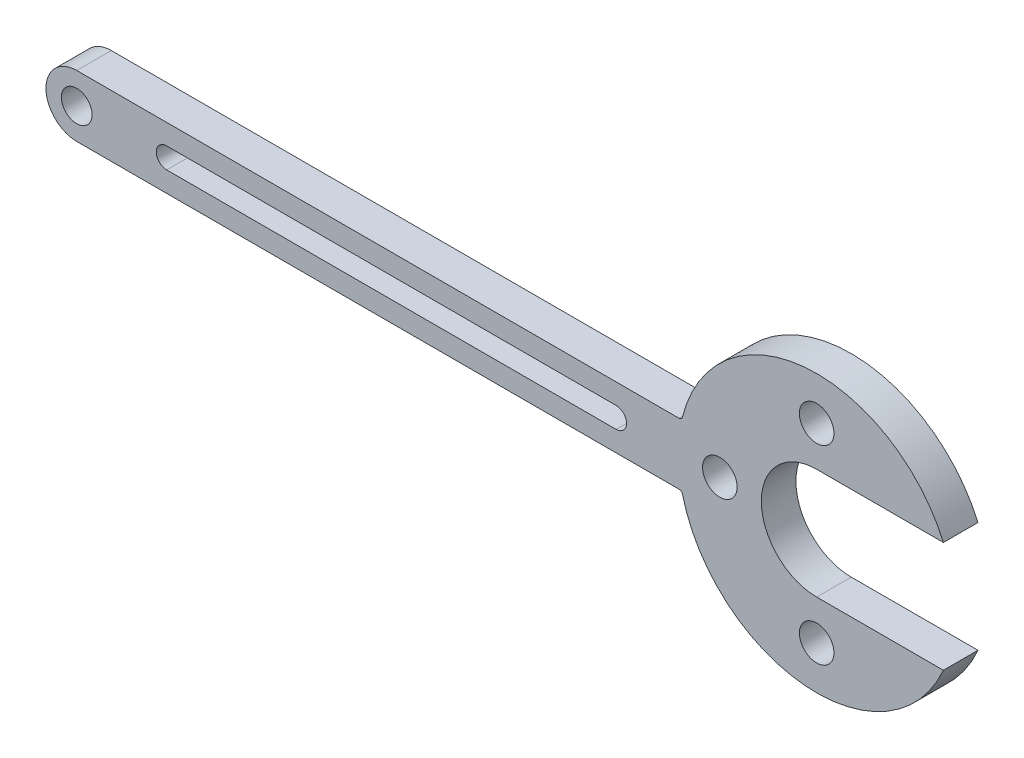
from build123d import *

# Parameters (mm, degrees)
SKETCH1_R           = 5
SKETCH1_R_2         = 4.435
BOSS_EXTRUDE1_DEPTH = 5


with BuildPart() as part:
    # Sketch1 → Boss-Extrude1 (new, symmetric)
    with BuildSketch(Plane.XY):
        with BuildLine():
            Line((36.66060556, 16), (0, 16))
            ThreePointArc((0, 16), (-16, 0), (0, -16))
            Line((0, -16), (36.66060556, -16))
            ThreePointArc((36.66060556, -16), (-3.354853263, -39.859063707), (-38.819261012, -9.647018944))
            ThreePointArc((-38.819261012, -9.647018944), (-39.173778039, -9.100420505), (-39.789742537, -8.888194417))
            Line((-39.789742537, -8.888194417), (-214, -8.888194417))
            ThreePointArc((-214, -8.888194417), (-222.888194417, 0), (-214, 8.888194417))
            Line((-214, 8.888194417), (-39.789742537, 8.888194417))
            ThreePointArc((-39.789742537, 8.888194417), (-39.173778039, 9.100420505), (-38.819261012, 9.647018944))
            ThreePointArc((-38.819261012, 9.647018944), (-3.354853263, 39.859063707), (36.66060556, 16))
        make_face()
        with Locations((0, 27.5)):
            Circle(SKETCH1_R, mode=Mode.SUBTRACT)
        with Locations((-28, 0)):
            Circle(SKETCH1_R, mode=Mode.SUBTRACT)
        with Locations((0, -27.5)):
            Circle(SKETCH1_R, mode=Mode.SUBTRACT)
        with Locations((-214, 0)):
            Circle(SKETCH1_R_2, mode=Mode.SUBTRACT)
        with BuildLine():
            Line((-188, 3), (-58, 3))
            ThreePointArc((-58, 3), (-55, 0), (-58, -3))
            Line((-58, -3), (-188, -3))
            ThreePointArc((-188, -3), (-191, 0), (-188, 3))
        make_face(mode=Mode.SUBTRACT)
    extrude(amount=BOSS_EXTRUDE1_DEPTH, both=True)


solid = part.part
